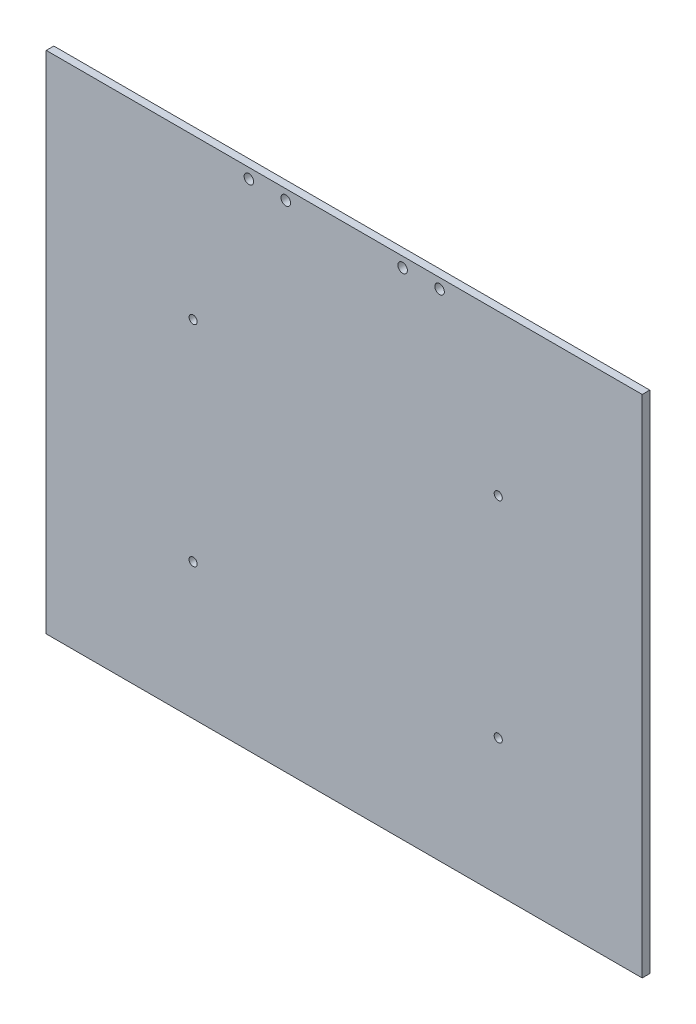
from build123d import *

# Parameters (mm, degrees)
SKETCH1_W           = 250
SKETCH1_H           = 212
SKETCH1_R           = 1.7
SKETCH1_R_2         = 2
BOSS_EXTRUDE1_DEPTH = 3.175


with BuildPart() as part:
    # Sketch1 → Boss-Extrude1 (new body)
    with BuildSketch(Plane.XY):
        with Locations((-94.717578185, 86.282204336)):
            Rectangle(SKETCH1_W, SKETCH1_H)
        with Locations((-158.104348788, 37.310775618)):
            Circle(SKETCH1_R, mode=Mode.SUBTRACT)
        with Locations((-30.104348788, 37.310775618)):
            Circle(SKETCH1_R, mode=Mode.SUBTRACT)
        with Locations((-158.104348788, 125.310775618)):
            Circle(SKETCH1_R, mode=Mode.SUBTRACT)
        with Locations((-30.104348788, 125.310775618)):
            Circle(SKETCH1_R, mode=Mode.SUBTRACT)
        with Locations((-54.717578185, 188.051399825)):
            Circle(SKETCH1_R_2, mode=Mode.SUBTRACT)
        with Locations((-70.217578185, 188.051399825)):
            Circle(SKETCH1_R_2, mode=Mode.SUBTRACT)
        with Locations((-119.217578185, 188.051399825)):
            Circle(SKETCH1_R_2, mode=Mode.SUBTRACT)
        with Locations((-134.717578185, 188.051399825)):
            Circle(SKETCH1_R_2, mode=Mode.SUBTRACT)
    extrude(amount=BOSS_EXTRUDE1_DEPTH)


solid = part.part
